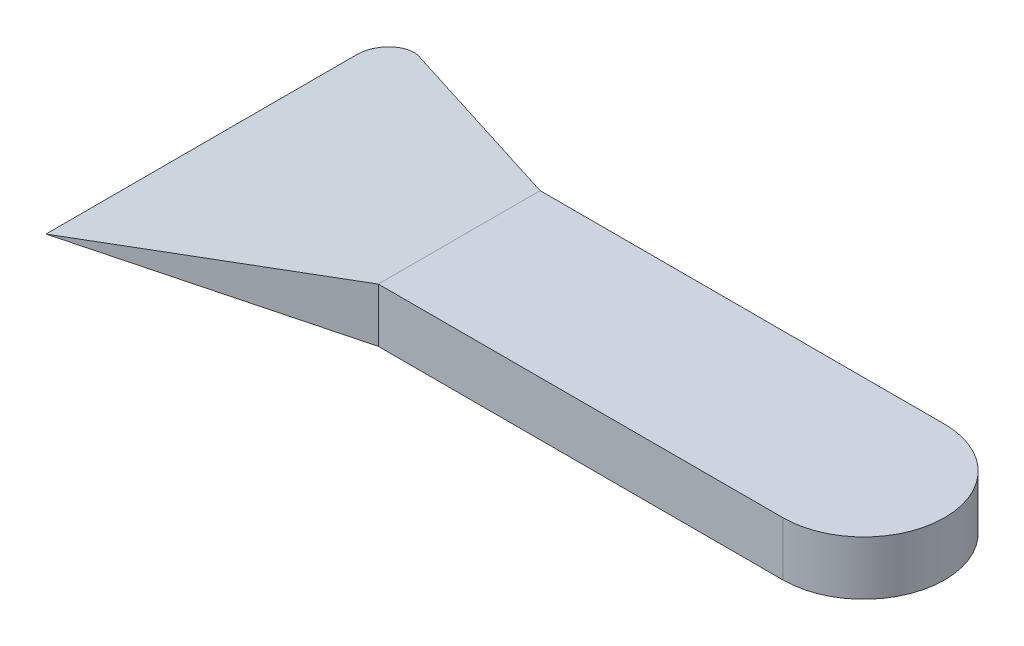
from build123d import *

# Parameters (mm, degrees)
BOSS_EXTRUDE1_DEPTH     = 2
CUT_EXTRUDE1_DEPTH      = 22.314348222
CUT_EXTRUDE1_DEPTH_BACK = 22.314348222
CUT_EXTRUDE2_DEPTH      = 22.314348222
CUT_EXTRUDE2_DEPTH_BACK = 22.314348222


with BuildPart() as part:
    # Sketch1 → Boss-Extrude1 (new body)
    with BuildSketch(Plane(origin=(0, 0, 0), x_dir=(1, 0, 0), z_dir=(0, 1, 0))):
        with BuildLine():
            Line((2.182949987, 3), (-5.217733039, 5.909415386))
            ThreePointArc((-5.217733039, 5.909415386), (-6.146688679, 5.80514872), (-6.583603739, 4.978749694))
            Line((-6.583603739, 4.978749694), (-6.583603739, -6.553622658))
            Line((-6.583603739, -6.553622658), (2.182949987, -3))
            Line((2.182949987, -3), (17.182949987, -3))
            ThreePointArc((17.182949987, -3), (20.182949987, 0), (17.182949987, 3))
            Line((17.182949987, 3), (2.182949987, 3))
        make_face()
    extrude(amount=BOSS_EXTRUDE1_DEPTH)

    # Sketch2 → Cut-Extrude1 (cut, two sides: drawn at the far end of the back side and taken through both)
    with BuildSketch(Plane.XY.offset(-CUT_EXTRUDE1_DEPTH_BACK)):
        Polygon((-6.583603739, 1), (2.182949987, 2), (-6.583603739, 2), align=None)
    extrude(amount=CUT_EXTRUDE1_DEPTH + CUT_EXTRUDE1_DEPTH_BACK, mode=Mode.SUBTRACT)

    # Sketch3 → Cut-Extrude2 (cut, two sides: drawn at the far end of the back side and taken through both)
    with BuildSketch(Plane.XY.offset(-CUT_EXTRUDE2_DEPTH_BACK)):
        Polygon((-6.583603739, 1), (-6.583603739, 0), (2.182949987, 0), align=None)
    extrude(amount=CUT_EXTRUDE2_DEPTH + CUT_EXTRUDE2_DEPTH_BACK, mode=Mode.SUBTRACT)


solid = part.part
